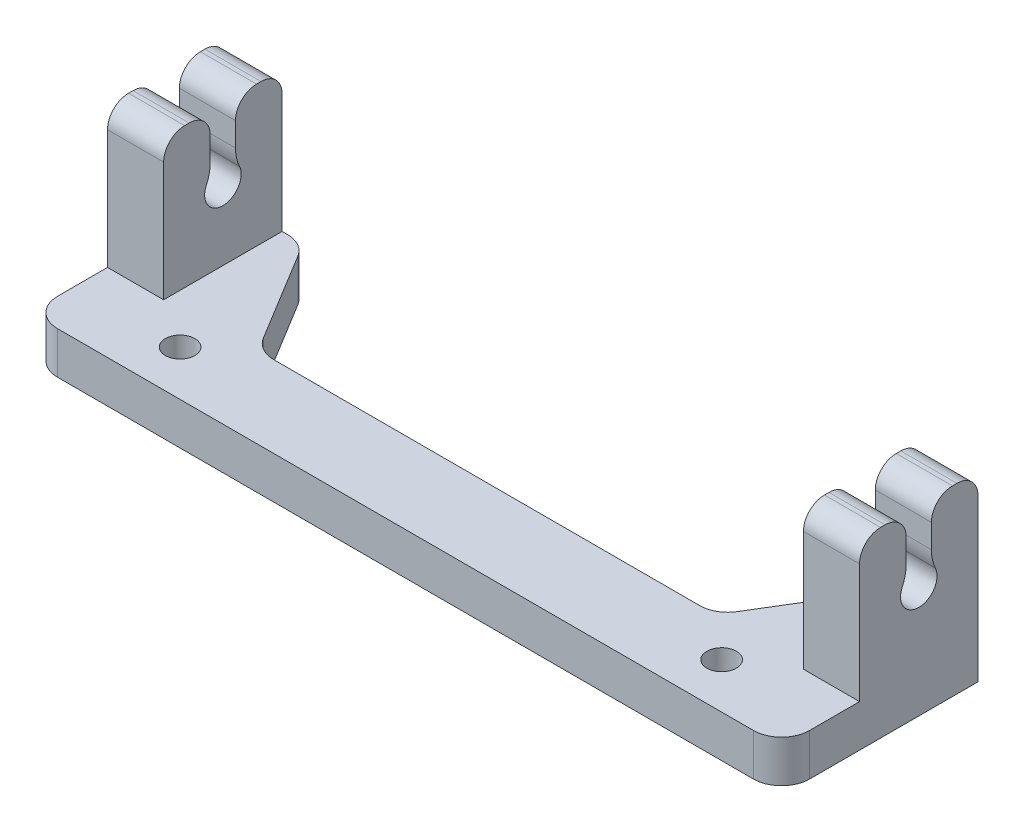
from build123d import *

# Parameters (mm, degrees)
SKETCH1_R           = 1.05
BOSS_EXTRUDE1_DEPTH = 3
SKETCH2_W           = 4
SKETCH2_H           = 8.44
BOSS_EXTRUDE2_DEPTH = 10
SKETCH3_R           = 1.3
CUT_EXTRUDE1_DEPTH  = 57.893656061
FILLET1_R           = 3
FILLET6_R           = 1.5


with BuildPart() as part:
    # Sketch1 → Boss-Extrude1 (new body)
    with BuildSketch(Plane(origin=(0, 0, 0), x_dir=(1, 0, 0), z_dir=(0, 1, 0))):
        with BuildLine():
            Line((0, 0), (24.457992021, 0))
            ThreePointArc((24.457992021, 0), (25.872205583, 0.585786438), (26.457992021, 2))
            Line((26.457992021, 2), (26.457992021, 14))
            Line((26.457992021, 14), (22.081671712, 14))
            ThreePointArc((22.081671712, 14), (21.102023762, 13.743642708), (20.373515707, 13.040289893))
            Line((20.373515707, 13.040289893), (16.542468334, 6.749710107))
            ThreePointArc((16.542468334, 6.749710107), (15.813960279, 6.046357292), (14.834312329, 5.79))
            Line((14.834312329, 5.79), (-15.508328288, 5.79))
            ThreePointArc((-15.508328288, 5.79), (-16.487976238, 6.046357292), (-17.216484293, 6.749710107))
            Line((-17.216484293, 6.749710107), (-21.047531666, 13.040289893))
            ThreePointArc((-21.047531666, 13.040289893), (-21.776039721, 13.743642708), (-22.755687671, 14))
            Line((-22.755687671, 14), (-27.132007979, 14))
            Line((-27.132007979, 14), (-27.132007979, 2))
            ThreePointArc((-27.132007979, 2), (-26.546221542, 0.585786438), (-25.132007979, 0))
            Line((-25.132007979, 0), (0, 0))
        make_face()
        with Locations(Location((18.957992021, 3.23, 0), (0, 0, 270))):
            Circle(SKETCH1_R, mode=Mode.SUBTRACT)
        with Locations(Location((-19.632007979, 3.23, 0), (0, 0, 270))):
            Circle(SKETCH1_R, mode=Mode.SUBTRACT)
    extrude(amount=BOSS_EXTRUDE1_DEPTH)

    # Sketch2 → Boss-Extrude2 (add)
    with BuildSketch(Plane(origin=(0, 3, 0), x_dir=(1, 0, 0), z_dir=(0, 1, 0))):
        with Locations((-25.132007979, 9.78)):
            Rectangle(SKETCH2_W, SKETCH2_H)
        with Locations((24.457992021, 9.78)):
            Rectangle(SKETCH2_W, SKETCH2_H)
    extrude(amount=BOSS_EXTRUDE2_DEPTH)

    # Sketch3 → Cut-Extrude1 (cut, through all)
    with BuildSketch(Plane(origin=(26.457992021, 0, 0), x_dir=(0, 0, -1), z_dir=(1, 0, 0))):
        with BuildLine():
            Line((10.68, 13), (8.88, 13))
            Line((8.88, 13), (8.88, 8.938083152))
            ThreePointArc((8.88, 8.938083152), (9.78, 9.3), (10.68, 8.938083152))
            Line((10.68, 8.938083152), (10.68, 13))
        make_face()
        with Locations((9.78, 8)):
            Circle(SKETCH3_R)
    extrude(amount=-CUT_EXTRUDE1_DEPTH, mode=Mode.SUBTRACT)

    # Fillet1
    fillet1_edges = [part.edges().sort_by_distance(p)[0] for p in [
        (-25.132007979, 8.938083152, -10.68),
        (24.457992021, 8.938083152, -10.68),
        (-25.132007979, 8.938083152, -8.88),
        (24.457992021, 8.938083152, -8.88),
    ]]
    fillet(fillet1_edges, radius=FILLET1_R)

    # Fillet6
    fillet6_edges = [part.edges().sort_by_distance(p)[0] for p in [
        (-25.132007979, 13, -5.56),
        (-25.132007979, 13, -14),
        (24.457992021, 13, -14),
        (24.457992021, 13, -5.56),
        (24.457992021, 13, -10.68),
        (24.457992021, 13, -8.88),
        (-25.132007979, 13, -8.88),
        (-25.132007979, 13, -10.68),
    ]]
    fillet(fillet6_edges, radius=FILLET6_R)


solid = part.part
